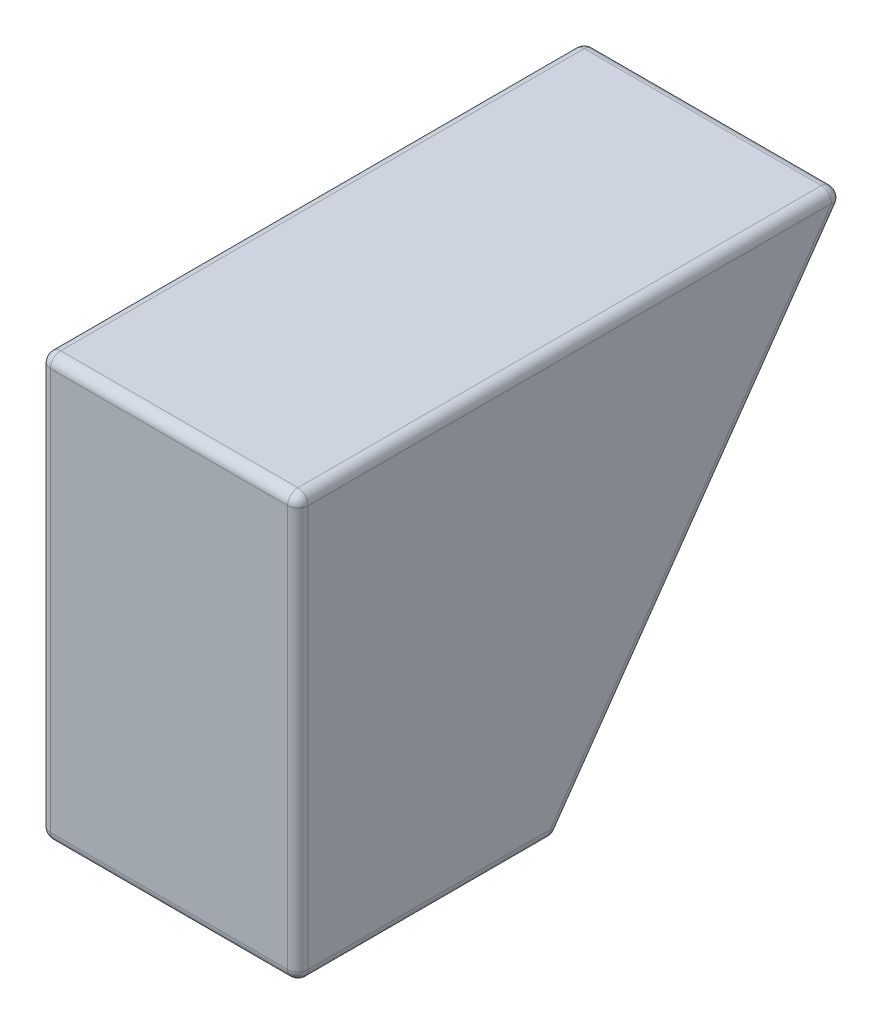
from build123d import *

# Parameters (mm, degrees)
BOSS_EXTRUDE1_DEPTH = 25
SKETCH3_R           = 5
CUT_EXTRUDE1_DEPTH  = 30
SKETCH8_W           = 15
SKETCH8_H           = 3
CUT_EXTRUDE10_DEPTH = 30
FILLET1_R           = 1
FILLET2_R           = 1


with BuildPart() as part:
    # Sketch2 → Boss-Extrude1 (new body)
    with BuildSketch(Plane(origin=(0, 0, 0), x_dir=(0, 0, -1), z_dir=(1, 0, 0))):
        Polygon((25, 40.957602214), (53.678821818, 40.957602214), (25, 0), (0, 0), (0, 40.957602214), align=None)
    extrude(amount=BOSS_EXTRUDE1_DEPTH)

    # Sketch3 → Cut-Extrude1 (cut)
    with BuildSketch(Plane.XZ):
        with Locations(Location((12.5, -12.5, 0), (0, 0, 270))):
            Circle(SKETCH3_R)
    extrude(amount=-CUT_EXTRUDE1_DEPTH, mode=Mode.SUBTRACT)

    # Sketch8 → Cut-Extrude10 (cut)
    with BuildSketch(Plane.XY.offset(-15)):
        with Locations((12.5, 5.957602214)):
            Rectangle(SKETCH8_W, SKETCH8_H)
    extrude(amount=-CUT_EXTRUDE10_DEPTH, mode=Mode.SUBTRACT)

    # Fillet1
    fillet1_edges = [part.edges().sort_by_distance(p)[0] for p in [
        (25, 0, -12.5),
        (25, 20.478801107, -39.339410909),
        (5, 5.957602214, -29.17155798),
        (20, 5.957602214, -29.17155798),
        (12.5, 4.457602214, -28.121246673),
        (12.5, 7.457602214, -30.221869288),
        (25, 40.957602214, -26.839410909),
        (0, 40.957602214, -26.839410909),
        (0, 20.478801107, -39.339410909),
        (0, 0, -12.5),
        (0, 20.478801107, 0),
        (25, 20.478801107, 0),
        (12.5, 40.957602214, -53.678821818),
        (12.5, 0, -25),
        (12.5, 0, 0),
        (12.5, 40.957602214, 0),
    ]]
    fillet(fillet1_edges, radius=FILLET1_R)

    # Fillet2
    fillet2_edges = [part.edges().sort_by_distance(p)[0] for p in [
        (12.5, 0, -7.5),
    ]]
    fillet(fillet2_edges, radius=FILLET2_R)


solid = part.part
